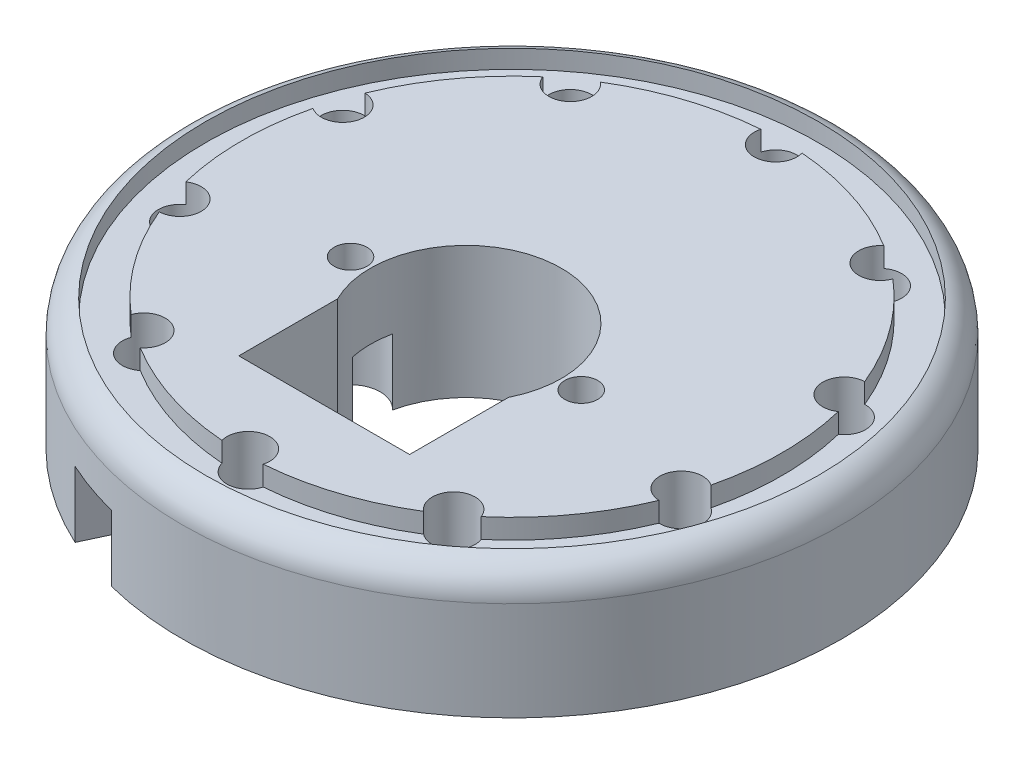
from build123d import *

# Parameters (mm, degrees)
SKETCH_1_R          = 50
EXTRUDE_1_DEPTH     = 20
FILLET_1_R          = 5
SKETCH_2_R          = 14.5
CUT_EXTRUDE_1_DEPTH = 20
SKETCH_3_R          = 2.5
SKETCH_3_W          = 25.922962794
SKETCH_3_H          = 15
CUT_EXTRUDE_2_DEPTH = 20
SKETCH_4_R          = 3.25
CUT_EXTRUDE_3_DEPTH = 74.484692352
SKETCH_5_R          = 43.25
SKETCH_5_R_2        = 36.75
CUT_EXTRUDE_4_DEPTH = 10
SKETCH_7_R          = 46.5
SKETCH_7_R_2        = 41
CUT_EXTRUDE_5_DEPTH = 3
CUT_EXTRUDE_6_DEPTH = 10
SKETCH_9_R          = 4.5
CUT_EXTRUDE_7_DEPTH = 10
SKETCH_10_R         = 3
EXTRUDE_2_DEPTH     = 5


with BuildPart() as part:
    # 草图1 → 凸台-拉伸1 (new body)
    with BuildSketch(Plane(origin=(0, 0, 0), x_dir=(1, 0, 0), z_dir=(0, 1, 0))):
        with Locations(Location((0, 0, 0), (0, 0, 270))):
            Circle(SKETCH_1_R)
    extrude(amount=EXTRUDE_1_DEPTH)

    # 圆角1
    fillet_1_edges = [part.edges().sort_by_distance(p)[0] for p in [
        (0, 20, -50),
    ]]
    fillet(fillet_1_edges, radius=FILLET_1_R)

    # 草图2 → 切除-拉伸1 (cut)
    with BuildSketch(Plane(origin=(0, 20, 0), x_dir=(1, 0, 0), z_dir=(0, 1, 0))):
        with Locations(Location((0, -7, 0), (0, 0, 270))):
            Circle(SKETCH_2_R)
    extrude(amount=-CUT_EXTRUDE_1_DEPTH, mode=Mode.SUBTRACT)

    # 草图3 → 切除-拉伸2 (cut)
    with BuildSketch(Plane(origin=(0, 20, 0), x_dir=(1, 0, 0), z_dir=(0, 1, 0))):
        with Locations(Location((-17.5, -7, 0), (0, 0, 270))):
            Circle(SKETCH_3_R)
        with Locations(Location((17.5, -7, 0), (0, 0, 270))):
            Circle(SKETCH_3_R)
        with Locations((0, -21)):
            Rectangle(SKETCH_3_W, SKETCH_3_H)
    extrude(amount=-CUT_EXTRUDE_2_DEPTH, mode=Mode.SUBTRACT)

    # 草图4 → 切除-拉伸3 (cut, through all)
    with BuildSketch(Plane(origin=(0, 20, 0), x_dir=(1, 0, 0), z_dir=(0, 1, 0))):
        with Locations(Location((0, 40, 0), (0, 0, 270))):
            Circle(SKETCH_4_R)
        with Locations(Location((23.511410092, 32.360679775, 0), (0, 0, 270))):
            Circle(SKETCH_4_R)
        with Locations(Location((38.042260652, 12.360679775, 0), (0, 0, 270))):
            Circle(SKETCH_4_R)
        with Locations(Location((38.042260652, -12.360679775, 0), (0, 0, 270))):
            Circle(SKETCH_4_R)
        with Locations(Location((23.511410092, -32.360679775, 0), (0, 0, 270))):
            Circle(SKETCH_4_R)
        with Locations(Location((0, -40, 0), (0, 0, 270))):
            Circle(SKETCH_4_R)
        with Locations(Location((-23.511410092, -32.360679775, 0), (0, 0, 270))):
            Circle(SKETCH_4_R)
        with Locations(Location((-38.042260652, -12.360679775, 0), (0, 0, 270))):
            Circle(SKETCH_4_R)
        with Locations(Location((-38.042260652, 12.360679775, 0), (0, 0, 270))):
            Circle(SKETCH_4_R)
        with Locations(Location((-23.511410092, 32.360679775, 0), (0, 0, 270))):
            Circle(SKETCH_4_R)
    extrude(amount=-CUT_EXTRUDE_3_DEPTH, mode=Mode.SUBTRACT)

    # 草图5 → 切除-拉伸4 (cut)
    with BuildSketch(Plane.XZ):
        with Locations(Location((0, 0, 0), (0, 0, 270))):
            Circle(SKETCH_5_R)
        with Locations(Location((0, 0, 0), (0, 0, 270))):
            Circle(SKETCH_5_R_2, mode=Mode.SUBTRACT)
    extrude(amount=-CUT_EXTRUDE_4_DEPTH, mode=Mode.SUBTRACT)

    # 草图7 → 切除-拉伸5 (cut)
    with BuildSketch(Plane(origin=(0, 20, 0), x_dir=(1, 0, 0), z_dir=(0, 1, 0))):
        with Locations(Location((0, 0, 0), (0, 0, 270))):
            Circle(SKETCH_7_R)
        Circle(SKETCH_7_R_2, mode=Mode.SUBTRACT)
    extrude(amount=-CUT_EXTRUDE_5_DEPTH, mode=Mode.SUBTRACT)

    # 草图8 → 切除-拉伸6 (cut)
    with BuildSketch(Plane.XZ):
        Polygon((-12.961481397, 28.5), (-22.041936512, 47.973098835), (-13.11038068, 50.264384749), (-2.961481397, 28.5), align=None)
    extrude(amount=-CUT_EXTRUDE_6_DEPTH, mode=Mode.SUBTRACT)

    # 草图9 → 切除-拉伸7 (cut)
    with BuildSketch(Plane.XZ):
        with Locations((-17.5, 7)):
            Circle(SKETCH_9_R)
        with Locations((17.5, 7)):
            Circle(SKETCH_9_R)
    extrude(amount=-CUT_EXTRUDE_7_DEPTH, mode=Mode.SUBTRACT)

    # 草图10 → 凸台-拉伸2 (add)
    with BuildSketch(Plane.XZ):
        with Locations(Location((0, -30, 0), (0, 0, 90))):
            Circle(SKETCH_10_R)
        with Locations(Location((-25.980762114, 15, 0), (0, 0, 90))):
            Circle(SKETCH_10_R)
        with Locations(Location((25.980762114, 15, 0), (0, 0, 90))):
            Circle(SKETCH_10_R)
    extrude(amount=EXTRUDE_2_DEPTH)


solid = part.part
